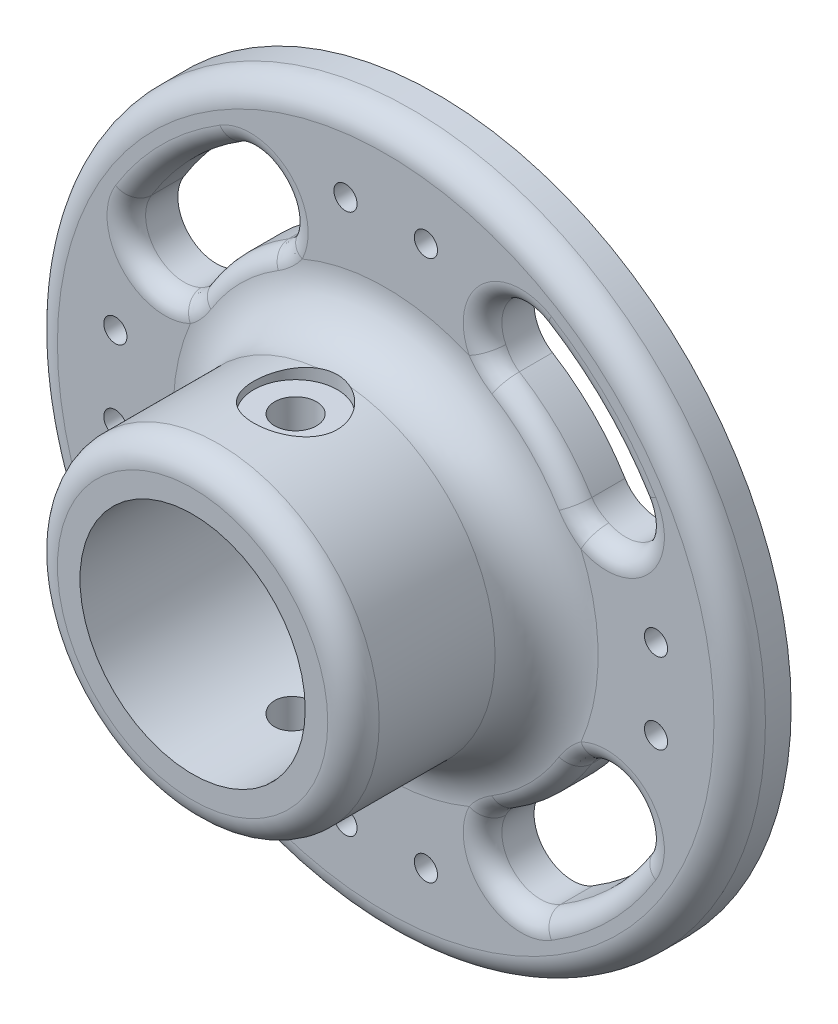
from build123d import *

# Parameters (mm, degrees)
SKETCH1_R           = 55
SKETCH1_R_2         = 1.8
BOSS_EXTRUDE1_DEPTH = 8
SKETCH4_R           = 25
BOSS_EXTRUDE3_DEPTH = 30
FILLET1_R           = 8
SKETCH5_R           = 3.25
CUT_EXTRUDE1_DEPTH  = 50
SKETCH6_R           = 14
CUT_EXTRUDE2_DEPTH  = 87.567892475
SKETCH7_R           = 17.5
CUT_EXTRUDE3_DEPTH  = 34
FILLET2_R           = 4
SKETCH8_R           = 6.5
CUT_EXTRUDE4_DEPTH  = 5
FILLET3_R           = 3


with BuildPart() as part:
    # Sketch1 → Boss-Extrude1 (new body)
    with BuildSketch(Plane.XY):
        Circle(SKETCH1_R)
        with Locations((-6.25, 42)):
            Circle(SKETCH1_R_2, mode=Mode.SUBTRACT)
        with Locations((6.25, 42)):
            Circle(SKETCH1_R_2, mode=Mode.SUBTRACT)
        with Locations((42, -6.25)):
            Circle(SKETCH1_R_2, mode=Mode.SUBTRACT)
        with Locations((42, 6.25)):
            Circle(SKETCH1_R_2, mode=Mode.SUBTRACT)
        with Locations((-6.25, -42)):
            Circle(SKETCH1_R_2, mode=Mode.SUBTRACT)
        with Locations((6.25, -42)):
            Circle(SKETCH1_R_2, mode=Mode.SUBTRACT)
        with Locations((-42, 6.25)):
            Circle(SKETCH1_R_2, mode=Mode.SUBTRACT)
        with Locations((-42, -6.25)):
            Circle(SKETCH1_R_2, mode=Mode.SUBTRACT)
        with BuildLine():
            ThreePointArc((-24.187160177, 39.408948079), (-32.696207013, 32.696207013), (-39.408948079, 24.187160177))
            ThreePointArc((-39.408948079, 24.187160177), (-37.433777789, 15.934966389), (-29.181584, 17.910136678))
            ThreePointArc((-29.181584, 17.910136678), (-24.210925639, 24.210925639), (-17.910136678, 29.181584))
            ThreePointArc((-17.910136678, 29.181584), (-15.934966389, 37.433777789), (-24.187160177, 39.408948079))
        make_face(mode=Mode.SUBTRACT)
        with BuildLine():
            ThreePointArc((39.408948079, 24.187160177), (32.696207013, 32.696207013), (24.187160177, 39.408948079))
            ThreePointArc((24.187160177, 39.408948079), (15.934966389, 37.433777789), (17.910136678, 29.181584))
            ThreePointArc((17.910136678, 29.181584), (24.210925639, 24.210925639), (29.181584, 17.910136678))
            ThreePointArc((29.181584, 17.910136678), (37.433777789, 15.934966389), (39.408948079, 24.187160177))
        make_face(mode=Mode.SUBTRACT)
        with BuildLine():
            ThreePointArc((24.187160177, -39.408948079), (32.696207013, -32.696207013), (39.408948079, -24.187160177))
            ThreePointArc((39.408948079, -24.187160177), (37.433777789, -15.934966389), (29.181584, -17.910136678))
            ThreePointArc((29.181584, -17.910136678), (24.210925639, -24.210925639), (17.910136678, -29.181584))
            ThreePointArc((17.910136678, -29.181584), (15.934966389, -37.433777789), (24.187160177, -39.408948079))
        make_face(mode=Mode.SUBTRACT)
        with BuildLine():
            ThreePointArc((-39.408948079, -24.187160177), (-32.696207013, -32.696207013), (-24.187160177, -39.408948079))
            ThreePointArc((-24.187160177, -39.408948079), (-15.934966389, -37.433777789), (-17.910136678, -29.181584))
            ThreePointArc((-17.910136678, -29.181584), (-24.210925639, -24.210925639), (-29.181584, -17.910136678))
            ThreePointArc((-29.181584, -17.910136678), (-37.433777789, -15.934966389), (-39.408948079, -24.187160177))
        make_face(mode=Mode.SUBTRACT)
    extrude(amount=BOSS_EXTRUDE1_DEPTH)

    # Sketch4 → Boss-Extrude3 (add)
    with BuildSketch(Plane.XY.offset(8)):
        Circle(SKETCH4_R)
    extrude(amount=BOSS_EXTRUDE3_DEPTH)

    # Fillet1
    fillet1_edges = [part.edges().sort_by_distance(p)[0] for p in [
        (-25, 0, 8),
    ]]
    fillet(fillet1_edges, radius=FILLET1_R)

    # Sketch5 → Cut-Extrude1 (cut, symmetric)
    with BuildSketch(Plane(origin=(0, 0, 0), x_dir=(1, 0, 0), z_dir=(0, 1, 0))):
        with Locations(Location((0, -22, 0), (0, 0, 270))):
            Circle(SKETCH5_R)
    extrude(amount=CUT_EXTRUDE1_DEPTH, both=True, mode=Mode.SUBTRACT)

    # Sketch6 → Cut-Extrude2 (cut, through all)
    with BuildSketch(Plane(origin=(0, 0, 0), x_dir=(-1, 0, 0), z_dir=(0, 0, -1))):
        Circle(SKETCH6_R)
    extrude(amount=-CUT_EXTRUDE2_DEPTH, mode=Mode.SUBTRACT)

    # Sketch7 → Cut-Extrude3 (cut)
    with BuildSketch(Plane.XY.offset(38)):
        Circle(SKETCH7_R)
    extrude(amount=-CUT_EXTRUDE3_DEPTH, mode=Mode.SUBTRACT)

    # Fillet2
    fillet2_edges = [part.edges().sort_by_distance(p)[0] for p in [
        (-55, 0, 8),
        (-25, 0, 38),
    ]]
    fillet(fillet2_edges, radius=FILLET2_R)

    # Sketch8 → Cut-Extrude4 (cut)
    with BuildSketch(Plane(origin=(0, -23, 0), x_dir=(1, 0, 0), z_dir=(0, 1, 0))):
        with Locations(Location((0, -22, 0), (0, 0, 270))):
            Circle(SKETCH8_R)
    cut_extrude4 = extrude(amount=-CUT_EXTRUDE4_DEPTH, mode=Mode.SUBTRACT)

    # Mirror1: Cut-Extrude4 across plane
    add(cut_extrude4.mirror(Plane.ZX), mode=Mode.SUBTRACT)

    # Fillet3
    fillet3_edges = [part.edges().sort_by_distance(p)[0] for p in [
        (-15.934966389, 37.433777789, 8),
        (-32.696207013, 32.696207013, 8),
        (-37.433777789, 15.934966389, 8),
        (-24.210925639, 24.210925639, 8),
        (37.433777789, 15.934966389, 8),
        (32.696207013, 32.696207013, 8),
        (15.934966389, 37.433777789, 8),
        (24.210925639, 24.210925639, 8),
        (15.934966389, -37.433777789, 8),
        (32.696207013, -32.696207013, 8),
        (37.433777789, -15.934966389, 8),
        (24.210925639, -24.210925639, 8),
        (-37.433777789, -15.934966389, 8),
        (-32.696207013, -32.696207013, 8),
        (-15.934966389, -37.433777789, 8),
        (-24.210925639, -24.210925639, 8),
    ]]
    fillet(fillet3_edges, radius=FILLET3_R)


solid = part.part
